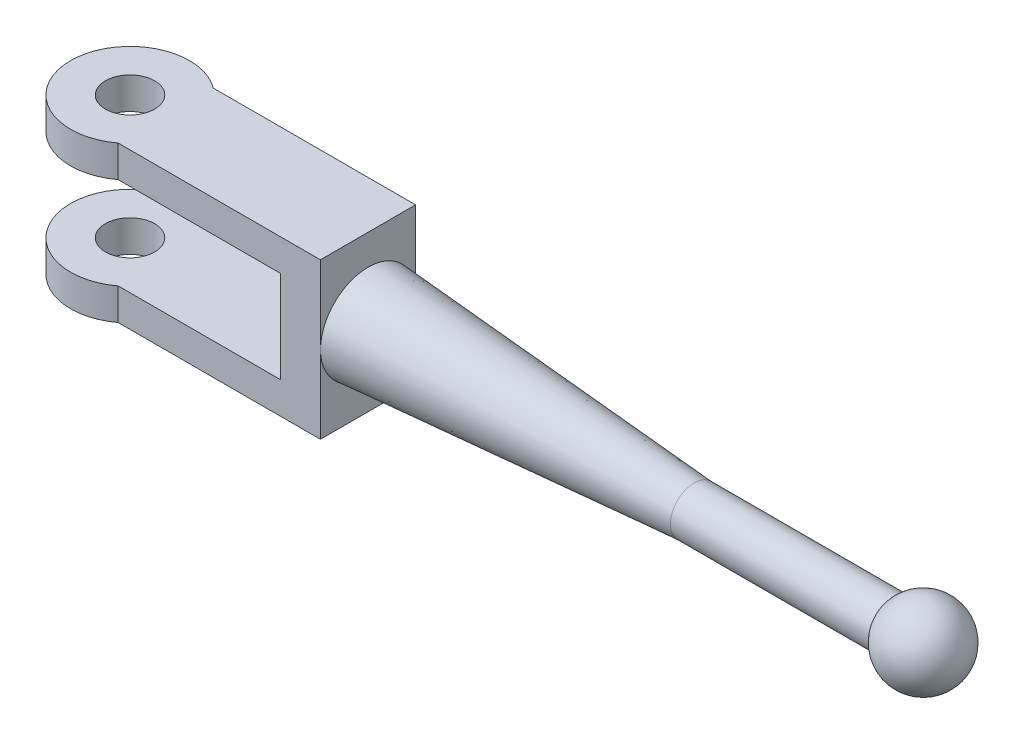
from build123d import *

# Parameters (mm, degrees)
SKETCH_1_R      = 3.1
EXTRUDE_1_DEPTH = 4
SKETCH_2_R      = 3.1
EXTRUDE_2_DEPTH = 4
SKETCH_3_W      = 12
SKETCH_3_H      = 19.6
EXTRUDE_3_DEPTH = 5
EXTRUDE_START   = -4
SKETCH_4_R      = 7.5
SKETCH_4_R_2    = 3.1
EXTRUDE_4_DEPTH = 4
SKETCH_5_R      = 7.5
SKETCH_5_R_2    = 3.1
EXTRUDE_5_DEPTH = 4


with BuildPart() as part:
    # 草图1 → 凸台-拉伸1 (new body)
    with BuildSketch(Plane(origin=(0, 0, 0), x_dir=(1, 0, 0), z_dir=(0, 1, 0))):
        with BuildLine():
            Line((0, 6), (30, 6))
            Line((30, 6), (30, -6))
            Line((30, -6), (0, -6))
            ThreePointArc((0, -6), (-6, 0), (0, 6))
        make_face()
        with Locations(Location((0, 0, 0), (0, 0, 270))):
            Circle(SKETCH_1_R, mode=Mode.SUBTRACT)
    extrude(amount=EXTRUDE_1_DEPTH)



with BuildPart() as body_2:
    # 草图2 → 凸台-拉伸2 (new body)
    with BuildSketch(Plane(origin=(0, 15.6, 0), x_dir=(1, 0, 0), z_dir=(0, 1, 0))):
        with BuildLine():
            Line((0, -6), (30, -6))
            Line((30, -6), (30, 6))
            Line((30, 6), (0, 6))
            ThreePointArc((0, 6), (-6, 0), (0, -6))
        make_face()
        with Locations(Location((0, 0, 0), (0, 0, 270))):
            Circle(SKETCH_2_R, mode=Mode.SUBTRACT)
    extrude(amount=EXTRUDE_2_DEPTH)


with BuildPart() as part_1:
    add(part.part)

    add(body_2.part)  # 凸台-拉伸3 merges body 2
    # 草图3 → 凸台-拉伸3 (add)
    with BuildSketch(Plane(origin=(30, 0, 0), x_dir=(0, 0, -1), z_dir=(1, 0, 0))):
        with Locations((0, 9.8)):
            Rectangle(SKETCH_3_W, SKETCH_3_H)
    extrude(amount=-EXTRUDE_3_DEPTH)

    # 草图4 → 凸台-拉伸4 (add)
    with BuildSketch(Plane(origin=(0, 19.6, 0), x_dir=(1, 0, 0), z_dir=(0, 1, 0)).offset(EXTRUDE_START)):
        Circle(SKETCH_4_R)
        with Locations(Location((0, 0, 0), (0, 0, 270))):
            Circle(SKETCH_4_R_2, mode=Mode.SUBTRACT)
    extrude(amount=EXTRUDE_4_DEPTH)

    # 草图5 → 凸台-拉伸5 (add)
    with BuildSketch(Plane.XZ):
        Circle(SKETCH_5_R)
        with Locations(Location((0, 0, 0), (0, 0, 90))):
            Circle(SKETCH_5_R_2, mode=Mode.SUBTRACT)
    extrude(amount=-EXTRUDE_5_DEPTH)


with BuildPart() as body_2_2:
    # 草图7 → 旋转1 (revolve)
    with BuildSketch(Plane.XY):
        with BuildLine():
            Line((96.125725874, 12.8), (71.125725874, 12.8))
            Line((71.125725874, 12.8), (30.01246024, 15.8))
            Line((30.01246024, 15.8), (30, 9.8))
            Line((30, 9.8), (104.9, 9.8))
            ThreePointArc((104.9, 9.8), (101.585253416, 14.436482676), (96.125725874, 12.8))
        make_face()
    revolve(axis=Axis((30, 9.8, 0), (1, 0, 0)))


solid = Compound([part_1.part, body_2_2.part])
